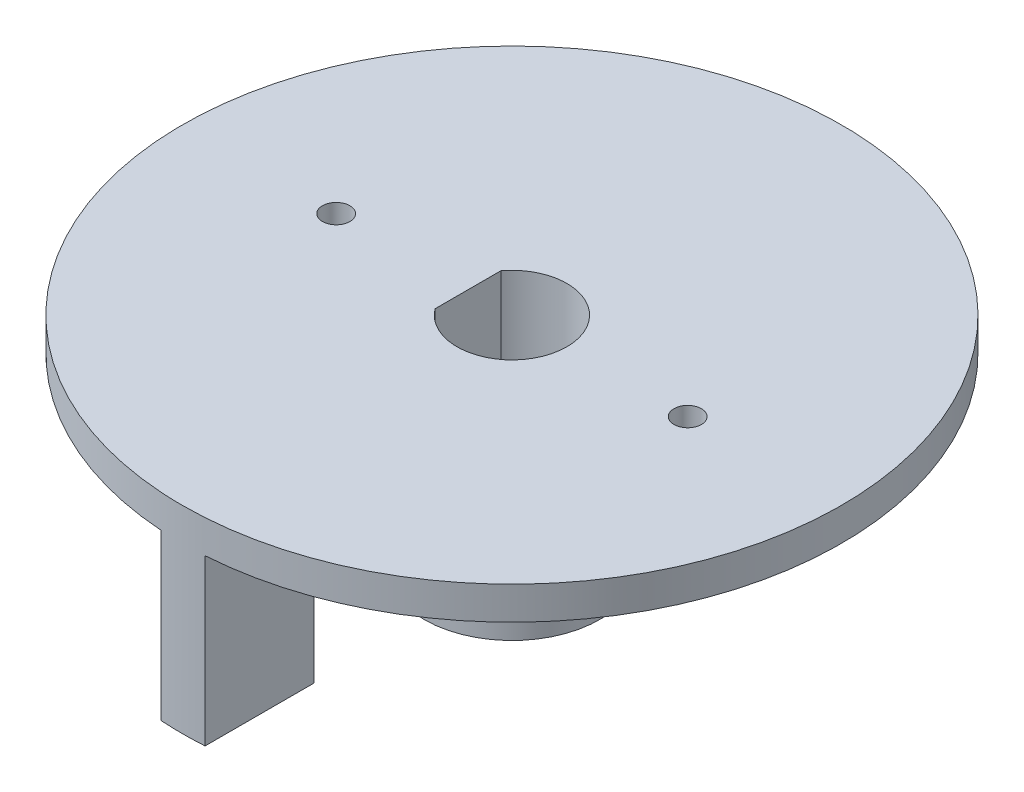
from build123d import *
from build123d.topology import SkipClean

# Parameters (mm, degrees)
SKETCH_1_R               = 8
EXTRUDE_1_DEPTH          = 17
SKETCH_2_R               = 30
EXTRUDE_2_DEPTH          = 3
CUT_EXTRUDE_1_DEPTH      = 47.904158
CUT_EXTRUDE_2_DEPTH      = 50.558047
CUT_EXTRUDE_2_DEPTH_BACK = 50.558047
SKETCH_4_R               = 1.15
EXTRUDE_START            = 15
EXTRUDE_3_DEPTH          = 15
FILLET_1_R               = 3
CUT_EXTRUDE_3_DEPTH      = 46.70558
CUT_EXTRUDE_3_DEPTH_BACK = 46.70558
SKETCH_6_R               = 1.25


with BuildPart() as part:
    # 草图1 → 凸台-拉伸1 (new body)
    with BuildSketch(Plane(origin=(0, 0, 0), x_dir=(1, 0, 0), z_dir=(0, 1, 0))):
        with Locations(Location((0, 0, 0), (0, 0, 270))):
            Circle(SKETCH_1_R)
    extrude(amount=EXTRUDE_1_DEPTH)

    # 草图2 → 凸台-拉伸2 (add)
    with BuildSketch(Plane(origin=(0, 17, 0), x_dir=(1, 0, 0), z_dir=(0, 1, 0))):
        with Locations(Location((0, 0, 0), (0, 0, 270))):
            Circle(SKETCH_2_R)
    extrude(amount=EXTRUDE_2_DEPTH)

    # 草图3 → 切除-拉伸1 (cut, through all)
    with BuildSketch(Plane.XZ):
        with BuildLine():
            Line((-4, 3), (-4, -3))
            ThreePointArc((-4, -3), (5, 0), (-4, 3))
        make_face()
    extrude(amount=-CUT_EXTRUDE_1_DEPTH, mode=Mode.SUBTRACT)

    # 草图4 → 切除-拉伸2 (cut, two sides: drawn at the far end of the back side and taken through both)
    with BuildSketch(Plane(origin=(-4, 0, 0), x_dir=(0, 0, -1), z_dir=(1, 0, 0)).offset(-CUT_EXTRUDE_2_DEPTH_BACK)):
        with Locations((0, 10)):
            Circle(SKETCH_4_R)
    extrude(amount=CUT_EXTRUDE_2_DEPTH + CUT_EXTRUDE_2_DEPTH_BACK, mode=Mode.SUBTRACT)

    # 草图5 → 凸台-拉伸3 (add)
    with SkipClean():  # the faces are left unmerged after this step: merging them gives an invalid solid
        with BuildSketch(Plane.XZ.offset(-17).offset(EXTRUDE_START)):
            with BuildLine():
                Line((-2, 29.933259), (-2, 20))
                Line((-2, 20), (2, 20))
                Line((2, 20), (2, 29.933259))
                ThreePointArc((2, 29.933259), (0, 30), (-2, 29.933259))
            make_face()
        extrude(amount=-EXTRUDE_3_DEPTH)

    # 圆角1
    fillet_1_edges = [part.edges().sort_by_distance(p)[0] for p in [
        (0, 17, -8),
    ]]
    fillet(fillet_1_edges, radius=FILLET_1_R)

    # 草图6 → 切除-拉伸3 (cut, two sides: drawn at the far end of the back side and taken through both)
    with SkipClean():  # the faces are left unmerged after this step: merging them gives an invalid solid
        with BuildSketch(Plane.XZ.offset(-17).offset(-CUT_EXTRUDE_3_DEPTH_BACK)):
            with Locations(Location((-16, 0, 0), (0, 0, 270))):
                Circle(SKETCH_6_R)
            with Locations(Location((16, 0, 0), (0, 0, 90))):
                Circle(SKETCH_6_R)
        extrude(amount=CUT_EXTRUDE_3_DEPTH + CUT_EXTRUDE_3_DEPTH_BACK, mode=Mode.SUBTRACT)


solid = part.part
